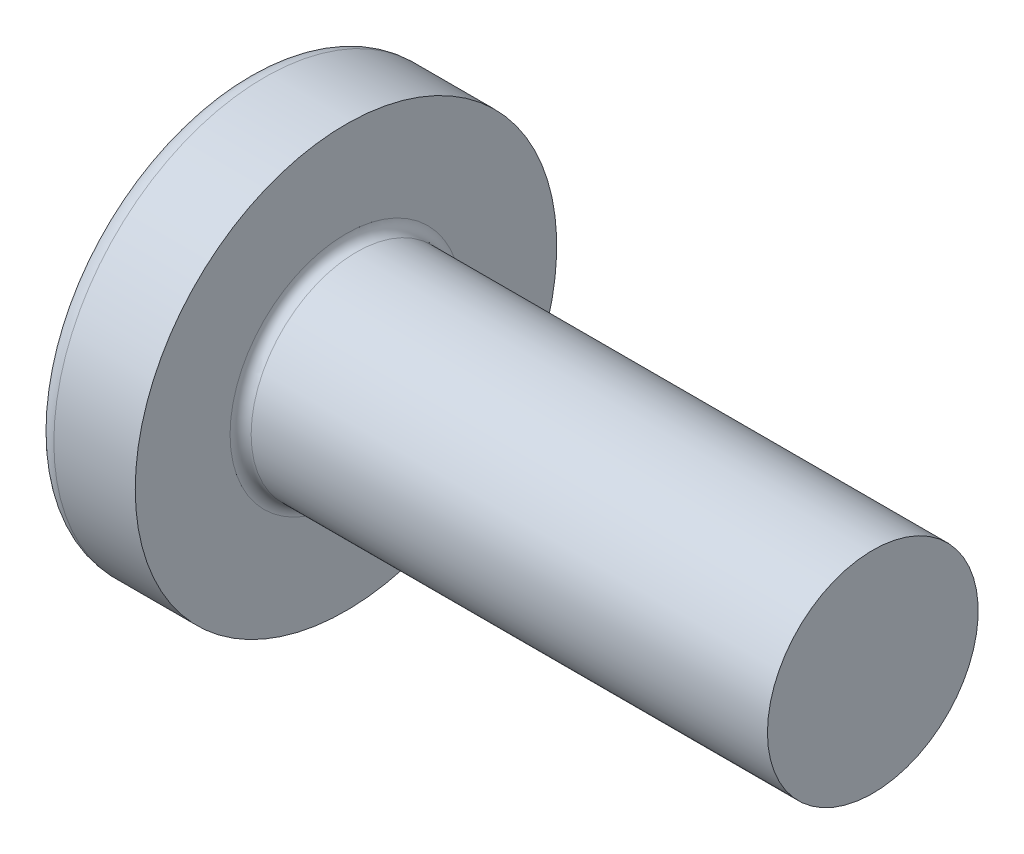
from build123d import *

# Parameters (mm, degrees)
FILLET1_R    = 0.2
RECPAT_COUNT = 2
RECPAT_ANGLE = 90


with BuildPart() as part:
    # BodySke → Base-Revolve (revolve)
    with BuildSketch(Plane.XY, mode=Mode.PRIVATE) as base_revolve_sk:
        with BuildLine():
            Line((3.1, 2), (3.1, 4))
            Line((3.1, 4), (1.555305874, 4))
            ThreePointArc((1.555305874, 4), (1.392873227, 3.961271902), (1.265388955, 3.853420195))
            ThreePointArc((1.265388955, 3.853420195), (0.324444487, 2.027933456), (0, 0))
            Line((0, 0), (13.1, 0))
            Line((13.1, 0), (13.1, 2))
            Line((13.1, 2), (3.1, 2))
        make_face()
    revolve(base_revolve_sk.sketch.rotate(Axis((1.555305874, 0, 0), (1, 0, 0)), 90), axis=Axis((1.555305874, 0, 0), (1, 0, 0)))

    # Fillet1
    fillet1_edges = [part.edges().sort_by_distance(p)[0] for p in [
        (3.1, 0, -2),
    ]]
    fillet(fillet1_edges, radius=FILLET1_R)

    # Sketch3 → Recess section 0
    with BuildSketch(Plane(origin=(0, 0, 0), x_dir=(0, 0, -1), z_dir=(1, 0, 0))):
        with BuildLine():
            Line((0.515, -2.15), (-0.515, -2.15))
            Line((-0.515, -2.15), (-0.515, 2.15))
            Line((-0.515, 2.15), (0.515, 2.15))
            Line((0.515, 2.15), (0.515, -2.15))
        make_face()
    # Sketch4 → Recess section 1
    with BuildSketch(Plane(origin=(2.34, 0, 0), x_dir=(0, 0, -1), z_dir=(1, 0, 0))):
        with BuildLine():
            Line((0.515, -0.983319232), (-0.515, -0.983319232))
            Line((-0.515, -0.983319232), (-0.515, 0.983319232))
            Line((-0.515, 0.983319232), (0.515, 0.983319232))
            Line((0.515, 0.983319232), (0.515, -0.983319232))
        make_face()
    recess = loft(mode=Mode.SUBTRACT)

    # RecPat: Recess ×2 about axis
    recpat_axis = Axis((0, 0, 0), (1, 0, 0))
    for i in range(1, RECPAT_COUNT):
        add(recess.rotate(recpat_axis, i * RECPAT_ANGLE / (RECPAT_COUNT - 1)), mode=Mode.SUBTRACT)

    # RecCorSke → RecessCore (revolve, cut)
    with BuildSketch(Plane.XY, mode=Mode.PRIVATE) as recesscore_sk:
        Polygon((0, 0), (0, 1.01462874), (2.34, 0.851), (2.616506661, 0), align=None)
    revolve(recesscore_sk.sketch.rotate(Axis((-3.175, 0, 0), (1, 0, 0)), 14.547591759), axis=Axis((-3.175, 0, 0), (1, 0, 0)), mode=Mode.SUBTRACT)


solid = part.part
